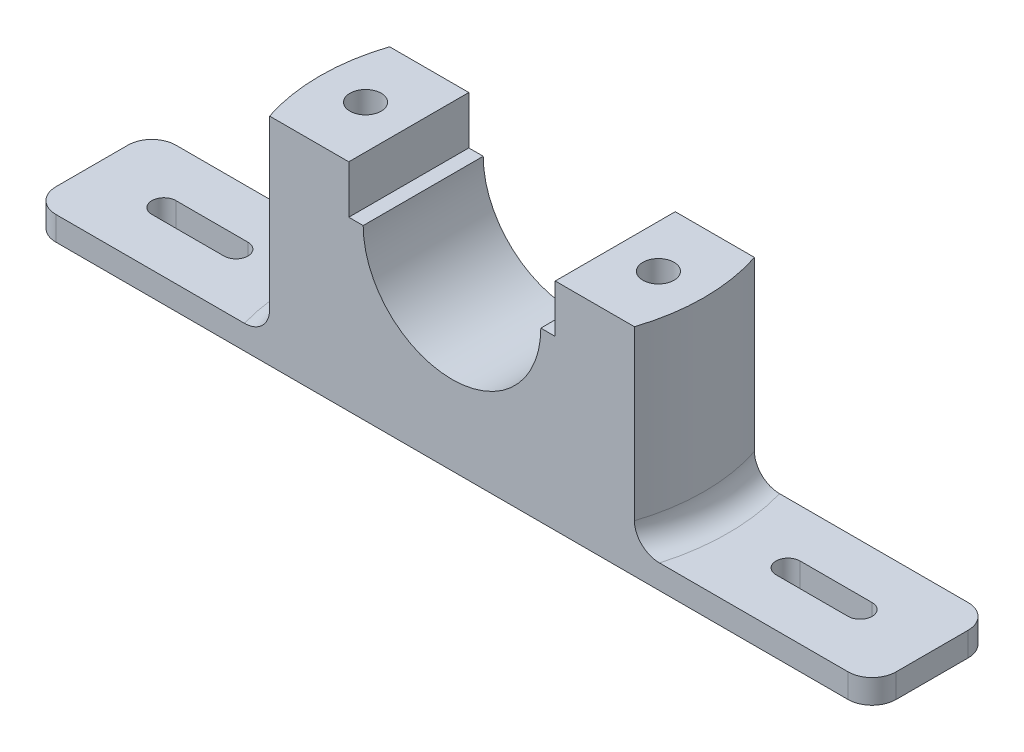
from build123d import *

# Parameters (mm, degrees)
BOSS_EXTRUDE5_DEPTH   = 5
BOSS_EXTRUDE5_2_DEPTH = 5
SKETCH1_8_R           = 3.25
BOSS_EXTRUDE6_DEPTH   = 45
FILLET3_R             = 5
FILLET4_R             = 5
CUT_EXTRUDE1_DEPTH    = 45


with BuildPart() as part:
    # Sketch1 → Boss-Extrude5 (new body)
    with BuildSketch(Plane(origin=(0, 0, 0), x_dir=(1, 0, 0), z_dir=(0, 1, 0))):
        with BuildLine():
            ThreePointArc((-82.5, 12.5), (-86.035533906, 11.035533906), (-87.5, 7.5))
            Line((-87.5, 7.5), (-87.5, -7.5))
            ThreePointArc((-87.5, -7.5), (-86.035533906, -11.035533906), (-82.5, -12.5))
            Line((-82.5, -12.5), (-37.996710384, -12.5))
            ThreePointArc((-37.996710384, -12.5), (-40, 0), (-37.996710384, 12.5))
            Line((-37.996710384, 12.5), (-82.5, 12.5))
        make_face()
        with BuildLine():
            ThreePointArc((-72.5, -2.5), (-75, 0), (-72.5, 2.5))
            Line((-72.5, 2.5), (-57.5, 2.5))
            ThreePointArc((-57.5, 2.5), (-55, 0), (-57.5, -2.5))
            Line((-57.5, -2.5), (-72.5, -2.5))
        make_face(mode=Mode.SUBTRACT)
    extrude(amount=BOSS_EXTRUDE5_DEPTH)



with BuildPart() as body_2:
    # Sketch1 → Boss-Extrude5 2 (new body)
    with BuildSketch(Plane(origin=(0, 0, 0), x_dir=(1, 0, 0), z_dir=(0, 1, 0))):
        with BuildLine():
            ThreePointArc((37.996710384, 12.5), (40, 0), (37.996710384, -12.5))
            Line((37.996710384, -12.5), (82.5, -12.5))
            ThreePointArc((82.5, -12.5), (86.035533906, -11.035533906), (87.5, -7.5))
            Line((87.5, -7.5), (87.5, 7.5))
            ThreePointArc((87.5, 7.5), (86.035533906, 11.035533906), (82.5, 12.5))
            Line((82.5, 12.5), (37.996710384, 12.5))
        make_face()
        with BuildLine():
            Line((72.5, -2.5), (57.5, -2.5))
            ThreePointArc((57.5, -2.5), (55, 0), (57.5, 2.5))
            Line((57.5, 2.5), (72.5, 2.5))
            ThreePointArc((72.5, 2.5), (75, 0), (72.5, -2.5))
        make_face(mode=Mode.SUBTRACT)
    extrude(amount=BOSS_EXTRUDE5_2_DEPTH)


with BuildPart() as part_1:
    add(part.part)

    add(body_2.part)  # Boss-Extrude6 merges body 2
    # Sketch1<8> → Boss-Extrude6 (add)
    with BuildSketch(Plane(origin=(0, 0, 0), x_dir=(1, 0, 0), z_dir=(0, 1, 0))):
        with BuildLine():
            ThreePointArc((-37.996710384, 12.5), (-40, 0), (-37.996710384, -12.5))
            Line((-37.996710384, -12.5), (37.996710384, -12.5))
            ThreePointArc((37.996710384, -12.5), (40, 0), (37.996710384, 12.5))
            Line((37.996710384, 12.5), (-37.996710384, 12.5))
        make_face()
        with Locations((-30.5, 0)):
            Circle(SKETCH1_8_R, mode=Mode.SUBTRACT)
        with Locations((30.5, 0)):
            Circle(SKETCH1_8_R, mode=Mode.SUBTRACT)
    extrude(amount=BOSS_EXTRUDE6_DEPTH)

    # Fillet3
    fillet3_edges = [part_1.edges().sort_by_distance(p)[0] for p in [
        (-40, 5, 0),
    ]]
    fillet(fillet3_edges, radius=FILLET3_R)

    # Fillet4
    fillet4_edges = [part_1.edges().sort_by_distance(p)[0] for p in [
        (40, 5, 0),
    ]]
    fillet(fillet4_edges, radius=FILLET4_R)

    # Sketch4 → Cut-Extrude1 (cut)
    with BuildSketch(Plane.XY.offset(12.5)):
        with BuildLine():
            Line((-21.496710384, 45), (-21.496710384, 35))
            Line((-21.496710384, 35), (-18.496710384, 35))
            ThreePointArc((-18.496710384, 35), (0.003289616, 16.5), (18.503289616, 35))
            Line((18.503289616, 35), (21.503289616, 35))
            Line((21.503289616, 35), (21.503289616, 45))
            Line((21.503289616, 45), (-21.496710384, 45))
        make_face()
    extrude(amount=-CUT_EXTRUDE1_DEPTH, mode=Mode.SUBTRACT)


solid = part_1.part
